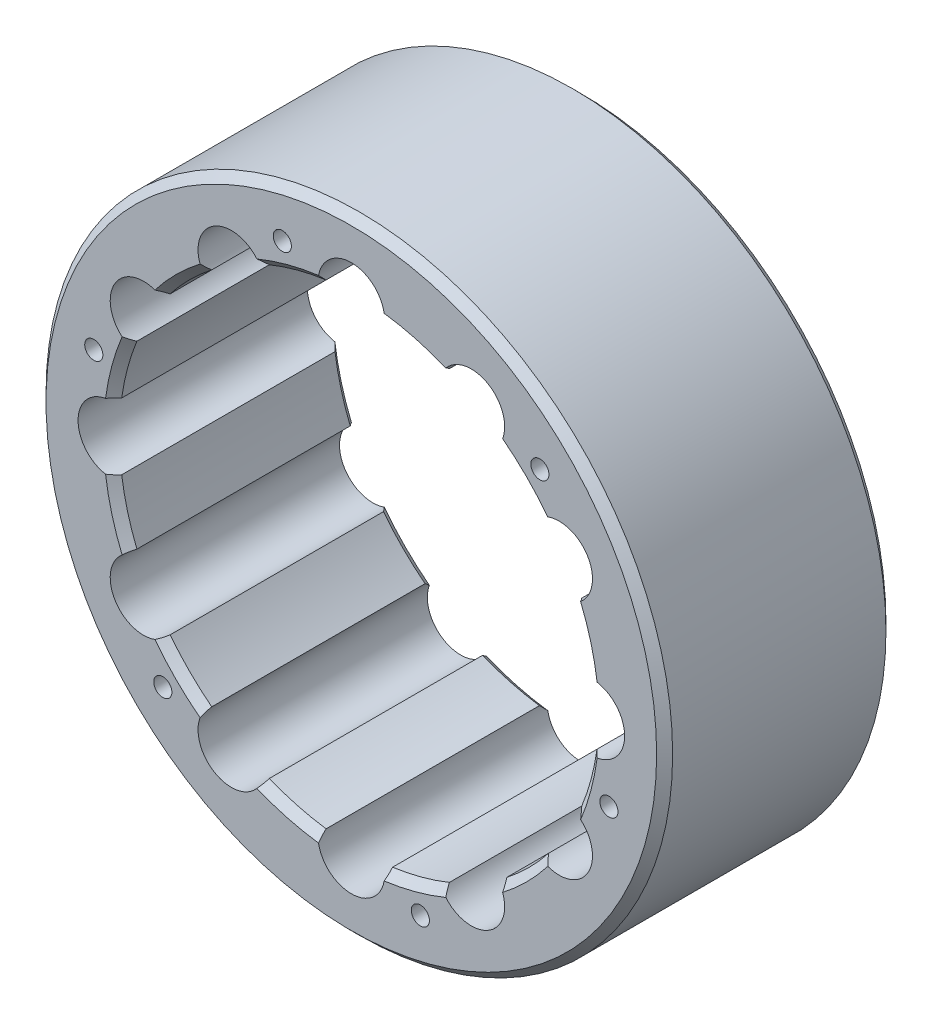
from build123d import *

# Parameters (mm, degrees)
SKETCH_1_R                       = 117.5
SKETCH_1_R_2                     = 90
EXTRUDE_1_DEPTH                  = 86
CHAMFER_1_SIZE                   = 3
SKETCH_2_R                       = 12.5
CUT_EXTRUDE_1_DEPTH              = 188.105585165
HOLE_WIZARD_M8_1_D               = 6.8
HOLE_WIZARD_M8_1_DEPTH           = 14
HOLE_WIZARD_M8_1_TIP             = 2.042926105
HOLE_WIZARD_M8_1_ON_FACE_2_D     = 6.8
HOLE_WIZARD_M8_1_ON_FACE_2_DEPTH = 14
HOLE_WIZARD_M8_1_ON_FACE_2_TIP   = 2.042926105
SCALE_1_SCALE                    = 0.2


with BuildPart() as part:
    # 草图1 → 凸台-拉伸1 (new body)
    with BuildSketch(Plane.XY):
        Circle(SKETCH_1_R)
        Circle(SKETCH_1_R_2, mode=Mode.SUBTRACT)
    extrude(amount=EXTRUDE_1_DEPTH)

    # 倒角1
    chamfer_1_edges = [part.edges().sort_by_distance(p)[0] for p in [
        (-117.5, 0, 0),
        (-117.5, 0, 86),
        (-90, 0, 0),
        (-90, 0, 86),
    ]]
    chamfer(chamfer_1_edges, length=CHAMFER_1_SIZE)

    # 草图2 → 切除-拉伸1 (cut, through all)
    with BuildSketch(Plane.XY.offset(86)):
        with Locations((0, 90)):
            Circle(SKETCH_2_R)
        with Locations((45, 77.942286341)):
            Circle(SKETCH_2_R)
        with Locations((77.942286341, 45)):
            Circle(SKETCH_2_R)
        with Locations((90, 0)):
            Circle(SKETCH_2_R)
        with Locations((77.942286341, -45)):
            Circle(SKETCH_2_R)
        with Locations((45, -77.942286341)):
            Circle(SKETCH_2_R)
        with Locations((0, -90)):
            Circle(SKETCH_2_R)
        with Locations((-45, -77.942286341)):
            Circle(SKETCH_2_R)
        with Locations((-77.942286341, -45)):
            Circle(SKETCH_2_R)
        with Locations((-90, 0)):
            Circle(SKETCH_2_R)
        with Locations((-77.942286341, 45)):
            Circle(SKETCH_2_R)
        with Locations((-45, 77.942286341)):
            Circle(SKETCH_2_R)
    extrude(amount=-CUT_EXTRUDE_1_DEPTH, mode=Mode.SUBTRACT)

    # M8 螺纹孔1
    with Locations(Plane(origin=(-25.88190451, 96.592582629, 86), x_dir=(1, 0, 0), z_dir=(0, 0, 1))):
        with Locations((0, 0), (96.592582629, -25.88190451), (-70.710678119, -70.710678119), (-44.828773609, -167.303260748), (51.76380902, -193.185165258), (122.474487139, -122.474487139)):
            Hole(HOLE_WIZARD_M8_1_D / 2, depth=HOLE_WIZARD_M8_1_DEPTH)
            with Locations((0, 0, -(HOLE_WIZARD_M8_1_DEPTH + HOLE_WIZARD_M8_1_TIP / 2))):  # 118° drill point
                Cone(0, HOLE_WIZARD_M8_1_D / 2, HOLE_WIZARD_M8_1_TIP, mode=Mode.SUBTRACT)

    # M8 螺纹孔1 on face 2
    with Locations(Plane(origin=(70.710678119, 70.710678119, 0), x_dir=(-1, 0, 0), z_dir=(0, 0, -1))):
        with Locations((0, 0), (96.592582629, 25.88190451), (167.303260748, -44.828773609), (141.421356238, -141.421356238), (44.828773609, -167.303260748), (-25.88190451, -96.592582629)):
            Hole(HOLE_WIZARD_M8_1_ON_FACE_2_D / 2, depth=HOLE_WIZARD_M8_1_ON_FACE_2_DEPTH)
            with Locations((0, 0, -(HOLE_WIZARD_M8_1_ON_FACE_2_DEPTH + HOLE_WIZARD_M8_1_ON_FACE_2_TIP / 2))):  # 118° drill point
                Cone(0, HOLE_WIZARD_M8_1_ON_FACE_2_D / 2, HOLE_WIZARD_M8_1_ON_FACE_2_TIP, mode=Mode.SUBTRACT)


with BuildPart() as part_1:
    # 缩放比例1: scaled about (0, 0, 0)
    add(part.part.scale(SCALE_1_SCALE))


solid = part_1.part
